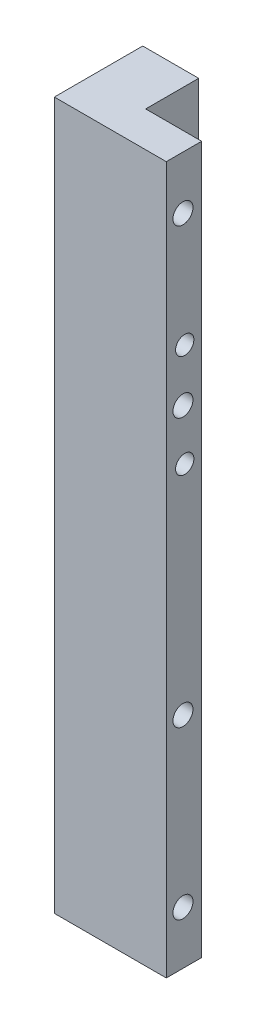
from build123d import *

# Parameters (mm, degrees)
SKETCH1_W           = 19
SKETCH1_H           = 6
SKETCH1_W_2         = 9.5
SKETCH1_H_2         = 9
BOSS_EXTRUDE1_DEPTH = 120
SKETCH2_R           = 1.7
SKETCH2_R_2         = 1.55
CUT_EXTRUDE1_DEPTH  = 19


with BuildPart() as part:
    # Sketch1 → Boss-Extrude1 (new body)
    with BuildSketch(Plane(origin=(0, 0, 0), x_dir=(1, 0, 0), z_dir=(0, 1, 0))):
        Rectangle(SKETCH1_W, SKETCH1_H)
        with Locations((-4.75, 7.5)):
            Rectangle(SKETCH1_W_2, SKETCH1_H_2)
    extrude(amount=BOSS_EXTRUDE1_DEPTH)

    # Sketch2 → Cut-Extrude1 (cut)
    with BuildSketch(Plane(origin=(9.5, 0, -9.5), x_dir=(0, 0, 1), z_dir=(-1, 0, 0))):
        with Locations(Location((9.670877536, 111, 0), (0, 0, 180))):
            Circle(SKETCH2_R)
        with Locations(Location((9.670877536, 82.75, 0), (0, 0, 180))):
            Circle(SKETCH2_R)
        with Locations(Location((9.670877536, 37.25, 0), (0, 0, 180))):
            Circle(SKETCH2_R)
        with Locations(Location((9.670877536, 9, 0), (0, 0, 180))):
            Circle(SKETCH2_R)
        with Locations(Location((9.370877536, 91.5, 0), (0, 0, 180))):
            Circle(SKETCH2_R_2)
        with Locations(Location((9.370877536, 74, 0), (0, 0, 180))):
            Circle(SKETCH2_R_2)
    extrude(amount=CUT_EXTRUDE1_DEPTH, mode=Mode.SUBTRACT)


solid = part.part
